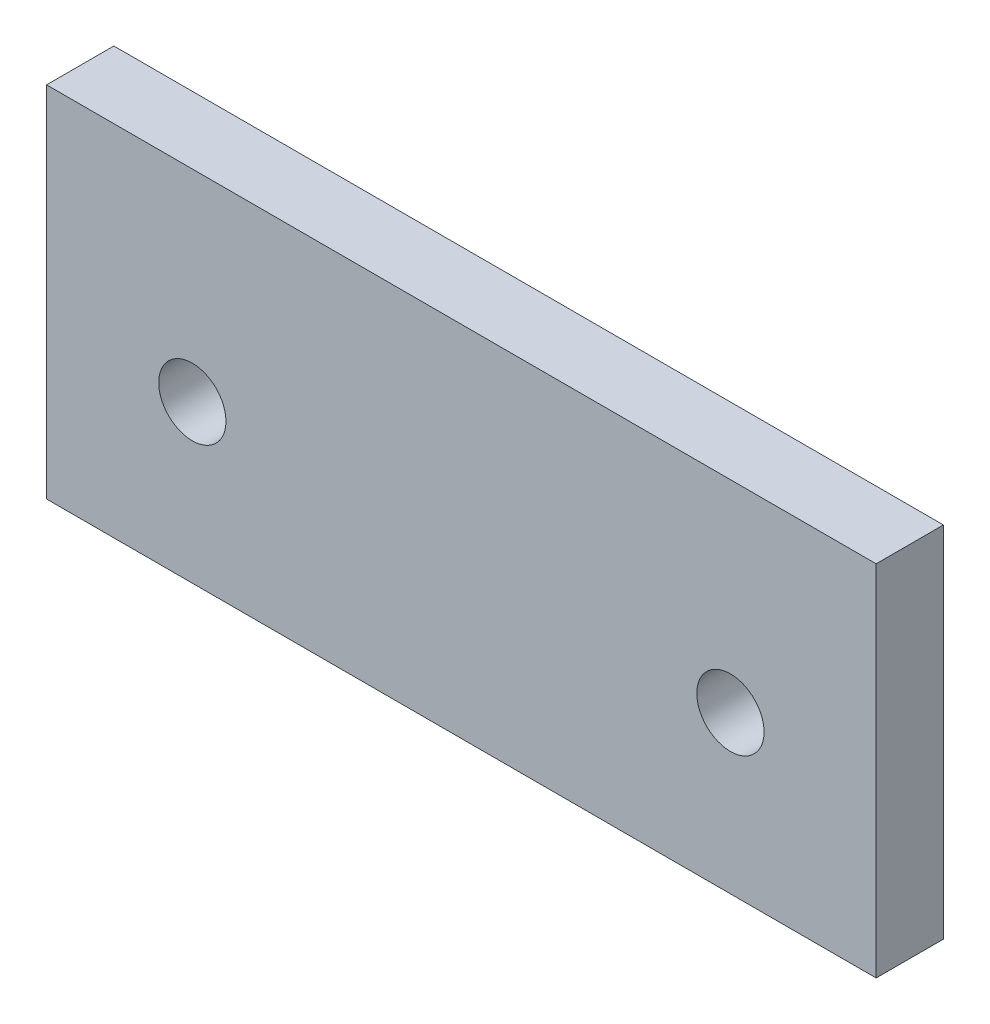
from build123d import *

# Parameters (mm, degrees)
SKETCH1_W           = 74
SKETCH1_H           = 32
BOSS_EXTRUDE1_DEPTH = 6
SKETCH2_R           = 3
CUT_EXTRUDE1_DEPTH  = 6


with BuildPart() as part:
    # Sketch1 → Boss-Extrude1 (new body)
    with BuildSketch(Plane.XY):
        with Locations((-37, 16)):
            Rectangle(SKETCH1_W, SKETCH1_H)
    extrude(amount=BOSS_EXTRUDE1_DEPTH)

    # Sketch2 → Cut-Extrude1 (cut)
    with BuildSketch(Plane.XY.offset(6)):
        with Locations((-13, 14)):
            Circle(SKETCH2_R)
        with Locations((-61, 14)):
            Circle(SKETCH2_R)
    extrude(amount=-CUT_EXTRUDE1_DEPTH, mode=Mode.SUBTRACT)


solid = part.part
